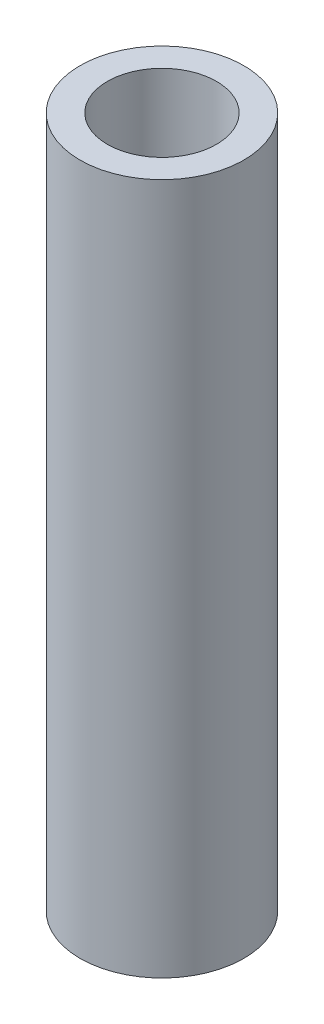
from build123d import *

# Parameters (mm, degrees)
SKETCH1_R           = 2.25
SKETCH1_R_2         = 1.5
BOSS_EXTRUDE1_DEPTH = 19


with BuildPart() as part:
    # Sketch1 → Boss-Extrude1 (new body)
    with BuildSketch(Plane(origin=(0, 0, 0), x_dir=(1, 0, 0), z_dir=(0, 1, 0))):
        with Locations(Location((0, 0, 0), (0, 0, 270))):
            Circle(SKETCH1_R)
        with Locations(Location((0, 0, 0), (0, 0, 270))):
            Circle(SKETCH1_R_2, mode=Mode.SUBTRACT)
    extrude(amount=BOSS_EXTRUDE1_DEPTH)


solid = part.part
